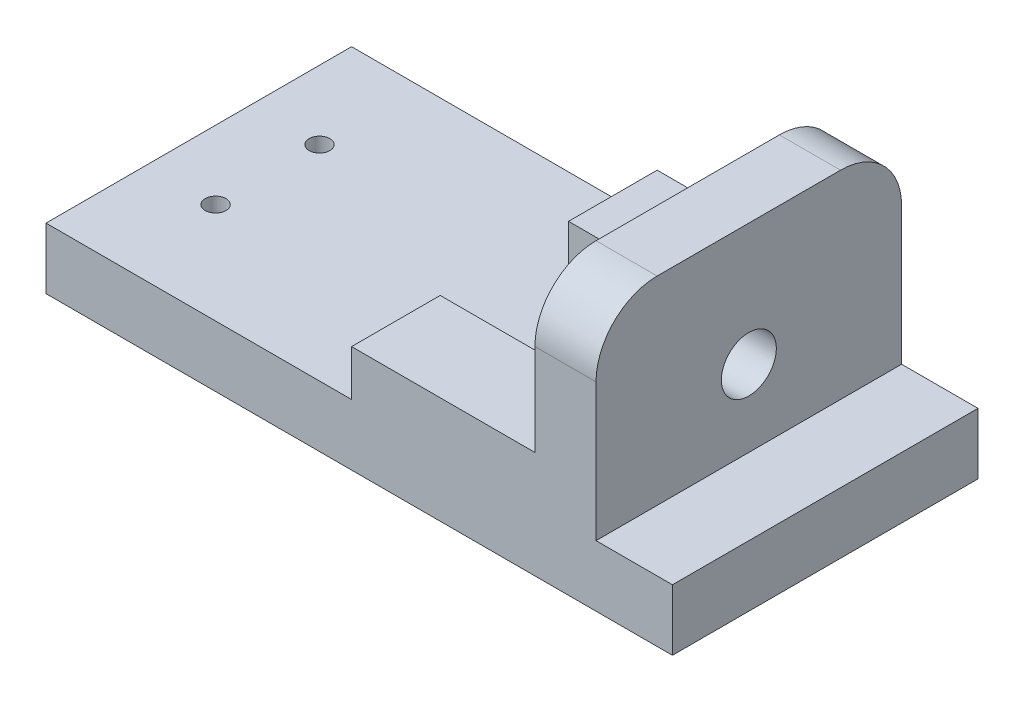
from build123d import *

# Parameters (mm, degrees)
SKETCH1_W                  = 205
SKETCH1_H                  = 100
BOSS_EXTRUDE1_DEPTH        = 20
M8_TAPPED_HOLE1_D          = 6.8
SKETCH4_W                  = 60
SKETCH4_H                  = 29
BOSS_EXTRUDE2_DEPTH        = 15
SKETCH5_W                  = 20
SKETCH5_H                  = 100
BOSS_EXTRUDE3_DEPTH        = 65
FILLET1_R                  = 20
F_18_0_18_DIAMETER_HOLE1_D = 18


with BuildPart() as part:
    # Sketch1 → Boss-Extrude1 (new body)
    with BuildSketch(Plane(origin=(0, 0, 0), x_dir=(1, 0, 0), z_dir=(0, 1, 0))):
        Rectangle(SKETCH1_W, SKETCH1_H)
    extrude(amount=BOSS_EXTRUDE1_DEPTH)

    # M8 Tapped Hole1 (through all)
    with Locations(Plane(origin=(-80, 20, -17), x_dir=(0, 0, 1), z_dir=(0, 1, 0))):
        with Locations((0, 0), (34, 0)):
            Hole(M8_TAPPED_HOLE1_D / 2)

    # Sketch4 → Boss-Extrude2 (add)
    with BuildSketch(Plane(origin=(0, 20, 0), x_dir=(1, 0, 0), z_dir=(0, 1, 0))):
        with Locations((27.5, -35.5)):
            Rectangle(SKETCH4_W, SKETCH4_H)
        with Locations((27.5, 35.5)):
            Rectangle(SKETCH4_W, SKETCH4_H)
    extrude(amount=BOSS_EXTRUDE2_DEPTH)

    # Sketch5 → Boss-Extrude3 (add)
    with BuildSketch(Plane(origin=(0, 20, 0), x_dir=(1, 0, 0), z_dir=(0, 1, 0))):
        with Locations((67.5, 0)):
            Rectangle(SKETCH5_W, SKETCH5_H)
    extrude(amount=BOSS_EXTRUDE3_DEPTH)

    # Fillet1
    fillet1_edges = [part.edges().sort_by_distance(p)[0] for p in [
        (67.5, 85, 50),
        (67.5, 85, -50),
    ]]
    fillet(fillet1_edges, radius=FILLET1_R)

    # Ø18.0 (18) Diameter Hole1 (through all)
    with Locations(Plane(origin=(57.5, 45, 0), x_dir=(0, 0, -1), z_dir=(-1, 0, 0))):
        with Locations((0, 0)):
            Hole(F_18_0_18_DIAMETER_HOLE1_D / 2)


solid = part.part
